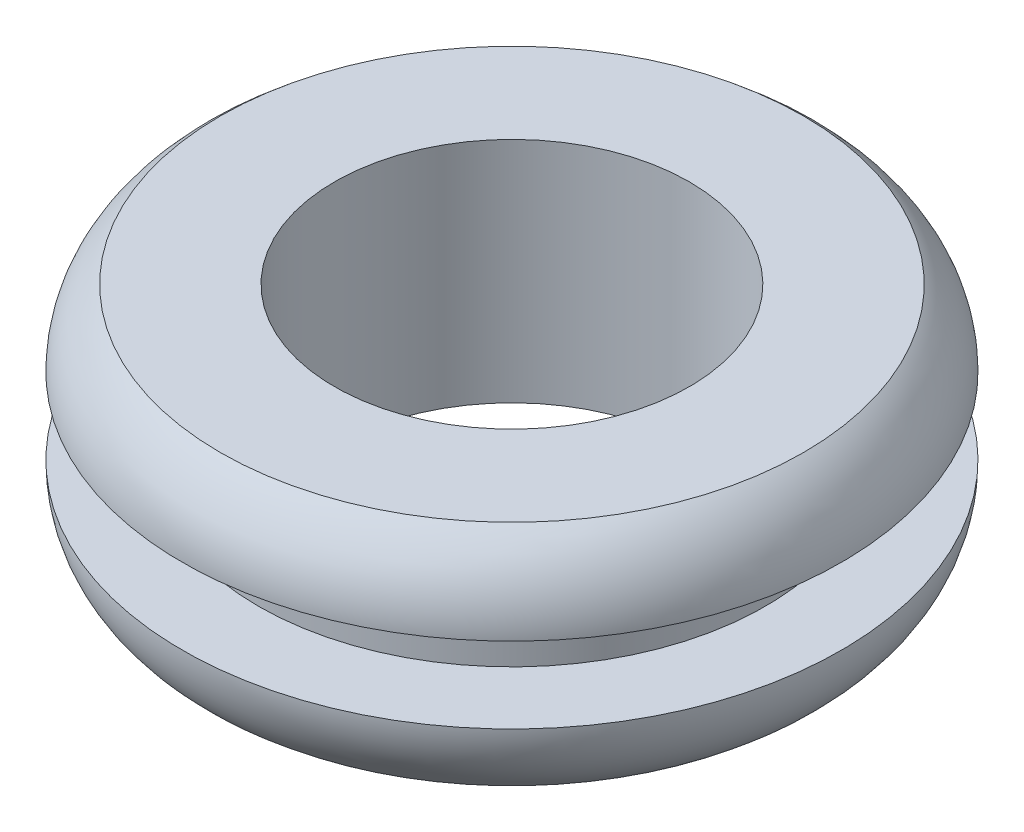
from build123d import *


with BuildPart() as part:
    # Sketch2 → Revolve1 (revolve)
    with BuildSketch(Plane(origin=(0, 0, 0), x_dir=(0, 0, -1), z_dir=(1, 0, 0)), mode=Mode.PRIVATE) as revolve1_sk:
        with BuildLine():
            Line((-11.1125, -7.14375), (-11.1125, 7.14375))
            Line((-11.1125, 7.14375), (-18.25625, 7.14375))
            ThreePointArc((-18.25625, 7.14375), (-20.009011871, 5.043568436), (-20.6375, 2.38125))
            Line((-20.6375, 2.38125), (-15.875, 2.38125))
            Line((-15.875, 2.38125), (-15.875, -2.38125))
            Line((-15.875, -2.38125), (-20.6375, -2.38125))
            ThreePointArc((-20.6375, -2.38125), (-20.009011871, -5.043568436), (-18.25625, -7.14375))
            Line((-18.25625, -7.14375), (-11.1125, -7.14375))
        make_face()
    revolve(revolve1_sk.sketch.rotate(Axis((0, -7.14375, 0), (0, 1, 0)), 180), axis=Axis((0, -7.14375, 0), (0, 1, 0)))


solid = part.part
